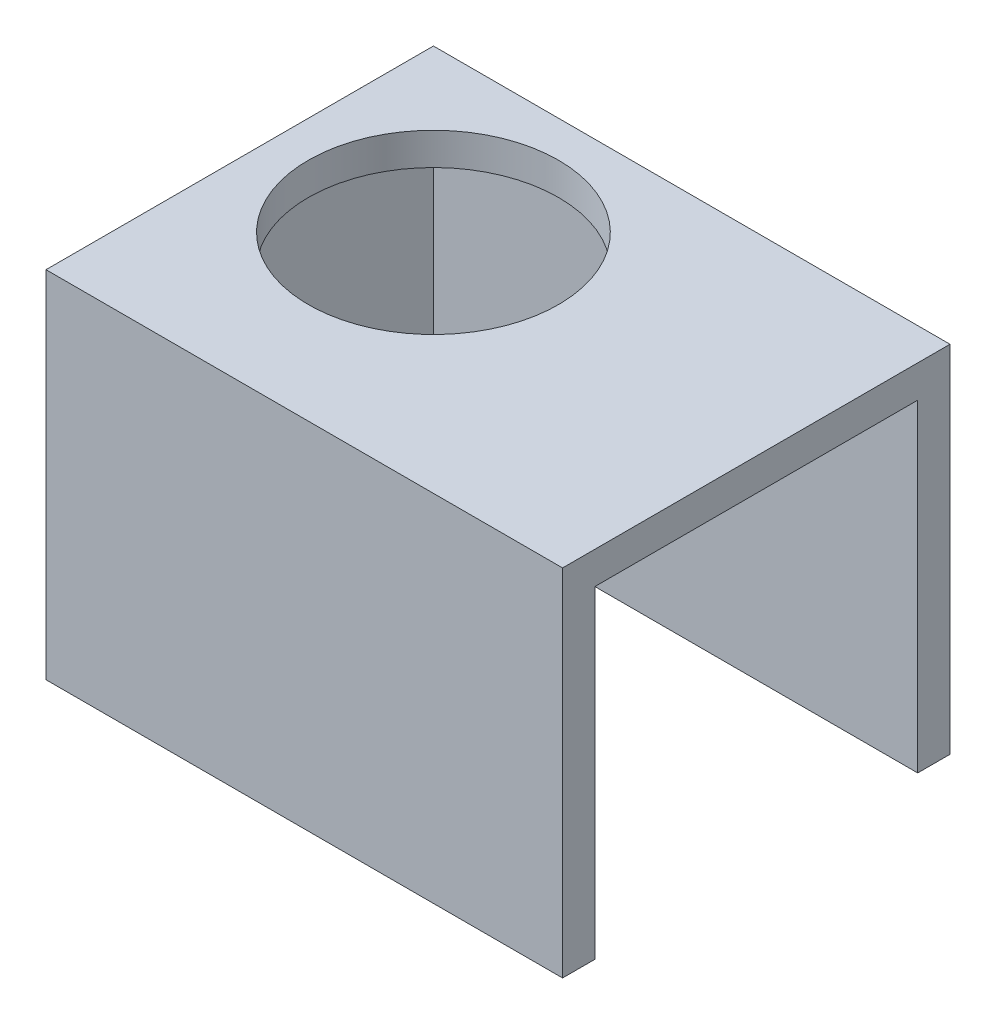
from build123d import *

# Parameters (mm, degrees)
CROQUIS1_W              = 32
CROQUIS1_H              = 24
SALIENTE_EXTRUIR1_DEPTH = 24
VACIADO1_T              = -2
CROQUIS2_R              = 7.75
CORTAR_EXTRUIR1_DEPTH   = 5
CROQUIS3_W              = 32
CROQUIS3_H              = 24
CORTAR_EXTRUIR2_DEPTH   = 2


with BuildPart() as part:
    # Croquis1 → Saliente-Extruir1 (new body)
    with BuildSketch(Plane(origin=(0, 0, 0), x_dir=(1, 0, 0), z_dir=(0, 1, 0))):
        Rectangle(CROQUIS1_W, CROQUIS1_H)
    extrude(amount=SALIENTE_EXTRUIR1_DEPTH)

    # Vaciado1
    vaciado1_openings = [part.faces().sort_by_distance(p)[0] for p in [
        (16, 12, 0),
    ]]
    offset(amount=VACIADO1_T, openings=vaciado1_openings, kind=Kind.INTERSECTION)

    # Croquis2 → Cortar-Extruir1 (cut)
    with BuildSketch(Plane(origin=(0, 22, 0), x_dir=(-1, 0, 0), z_dir=(0, -1, 0))):
        with Locations(Location((6, 2, 0), (0, 0, 90))):
            Circle(CROQUIS2_R)
    extrude(amount=-CORTAR_EXTRUIR1_DEPTH, mode=Mode.SUBTRACT)

    # Croquis3 → Cortar-Extruir2 (cut)
    with BuildSketch(Plane(origin=(0, 0, 0), x_dir=(-1, 0, 0), z_dir=(0, -1, 0))):
        Rectangle(CROQUIS3_W, CROQUIS3_H)
    extrude(amount=-CORTAR_EXTRUIR2_DEPTH, mode=Mode.SUBTRACT)


solid = part.part
